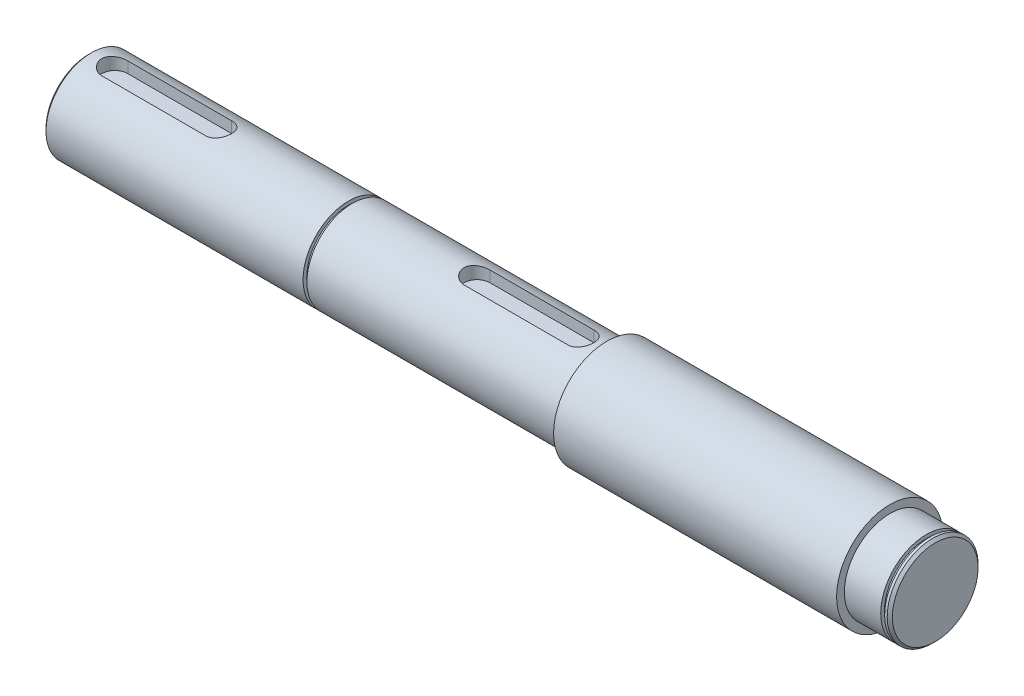
from build123d import *

# Parameters (mm, degrees)
CUT_EXTRUDE1_DEPTH = 5
CUT_EXTRUDE2_DEPTH = 5


with BuildPart() as part:
    # Sketch1 → Revolve1 (revolve)
    with BuildSketch(Plane.XY, mode=Mode.PRIVATE) as revolve1_sk:
        Polygon((0, 0), (326, 0), (326, 16.5), (325, 17.5), (324, 17.5), (324, 16.1), (322.5, 16.1), (322.5, 17.5), (308.5, 17.5), (308.5, 20.5), (199.5, 20.5), (199.5, 17.5), (101.5, 17.5), (101.5, 16.1), (100, 16.1), (100, 17.5), (1, 17.5), (0, 16.5), align=None)
    revolve(revolve1_sk.sketch.rotate(Axis((0, 0, 0), (1, 0, 0)), 90), axis=Axis((0, 0, 0), (1, 0, 0)))

    # Sketch2 → Cut-Extrude1 (cut)
    with BuildSketch(Plane(origin=(0, 17.5, 0), x_dir=(1, 0, 0), z_dir=(0, 1, 0))):
        with BuildLine():
            Line((189.5, -5), (149.5, -5))
            ThreePointArc((149.5, -5), (144.5, 0), (149.5, 5))
            Line((149.5, 5), (189.5, 5))
            ThreePointArc((189.5, 5), (194.5, 0), (189.5, -5))
        make_face()
    extrude(amount=-CUT_EXTRUDE1_DEPTH, mode=Mode.SUBTRACT)

    # Sketch3 → Cut-Extrude2 (cut)
    with BuildSketch(Plane(origin=(0, 17.5, 0), x_dir=(1, 0, 0), z_dir=(0, 1, 0))):
        with BuildLine():
            Line((189.5, 5), (149.5, 5))
            ThreePointArc((149.5, 5), (144.5, 0), (149.5, -5))
            Line((149.5, -5), (189.5, -5))
            ThreePointArc((189.5, -5), (194.5, 0), (189.5, 5))
        make_face()
        with BuildLine():
            Line((10, 5), (50, 5))
            ThreePointArc((50, 5), (55, 0), (50, -5))
            Line((50, -5), (10, -5))
            ThreePointArc((10, -5), (5, 0), (10, 5))
        make_face()
    extrude(amount=-CUT_EXTRUDE2_DEPTH, mode=Mode.SUBTRACT)


solid = part.part
